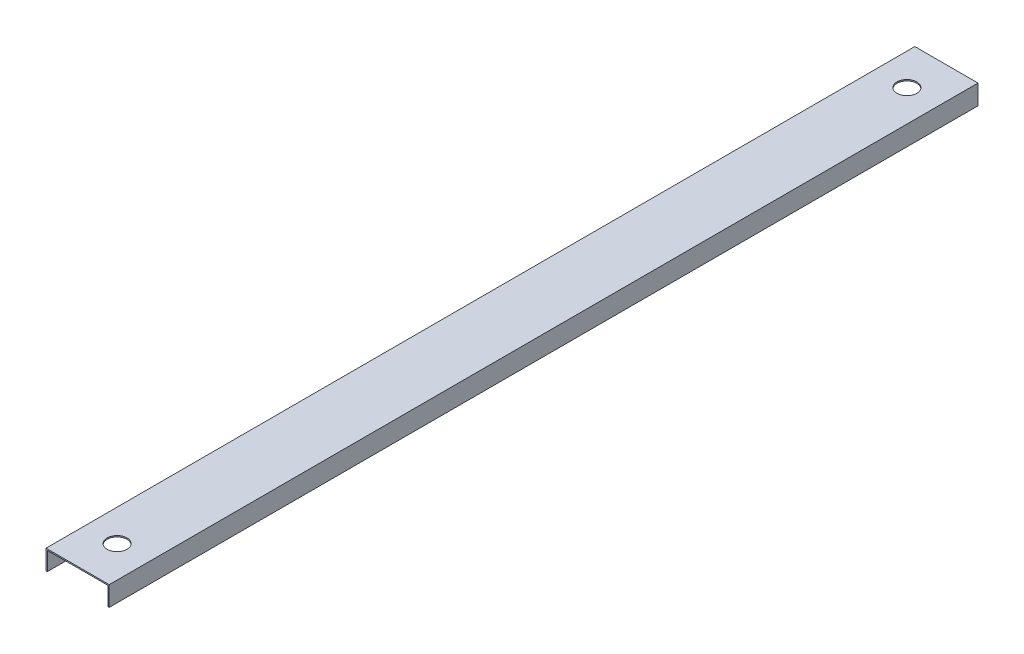
from build123d import *

# Parameters (mm, degrees)
BOSS_EXTRUDE1_DEPTH = 279.4
SKETCH2_R           = 3.1877
CUT_EXTRUDE1_DEPTH  = 280.656768379


with BuildPart() as part:
    # Sketch1 → Boss-Extrude1 (new body)
    with BuildSketch(Plane.XY):
        Polygon((-10.16, 0), (-10.16, 6.35), (10.16, 6.35), (10.16, 0), (9.7536, 0), (9.7536, 5.9436), (-9.7536, 5.9436), (-9.7536, 0), align=None)
    extrude(amount=-BOSS_EXTRUDE1_DEPTH)

    # Sketch2 → Cut-Extrude1 (cut, through all)
    with BuildSketch(Plane(origin=(0, 6.35, 0), x_dir=(1, 0, 0), z_dir=(0, 1, 0))):
        with Locations(Location((0, 266.7, 0), (0, 0, 270))):
            Circle(SKETCH2_R)
        with Locations(Location((0, 12.7, 0), (0, 0, 270))):
            Circle(SKETCH2_R)
    extrude(amount=-CUT_EXTRUDE1_DEPTH, mode=Mode.SUBTRACT)


solid = part.part
